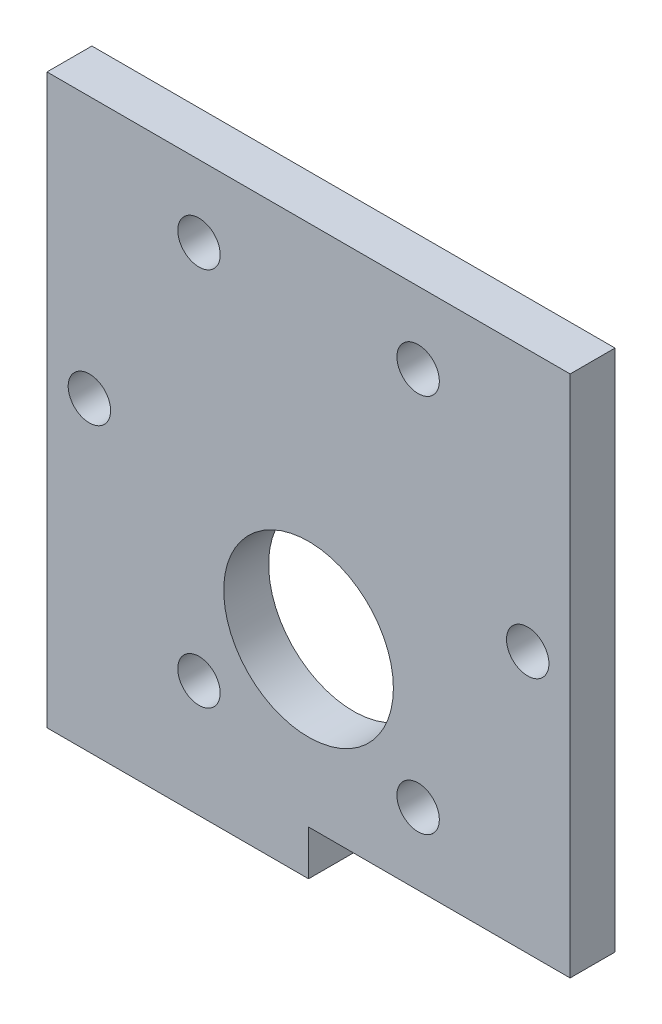
from build123d import *

# Parameters (mm, degrees)
SKETCH1_R           = 6
SKETCH1_R_2         = 1.5
BOSS_EXTRUDE1_DEPTH = 3.175


with BuildPart() as part:
    # Sketch1 → Boss-Extrude1 (new body)
    with BuildSketch(Plane.XY):
        Polygon((18.5, 0), (18.5, -3.175), (0, -3.175), (0, 0), (0, 37), (37, 37), (37, 0), align=None)
        with Locations((18.5, 11.5)):
            Circle(SKETCH1_R, mode=Mode.SUBTRACT)
        with Locations((34, 18.5)):
            Circle(SKETCH1_R_2, mode=Mode.SUBTRACT)
        with Locations((26.25, 5.076606241)):
            Circle(SKETCH1_R_2, mode=Mode.SUBTRACT)
        with Locations((10.75, 5.076606241)):
            Circle(SKETCH1_R_2, mode=Mode.SUBTRACT)
        with Locations((3, 18.5)):
            Circle(SKETCH1_R_2, mode=Mode.SUBTRACT)
        with Locations((10.75, 31.923393759)):
            Circle(SKETCH1_R_2, mode=Mode.SUBTRACT)
        with Locations((26.25, 31.923393759)):
            Circle(SKETCH1_R_2, mode=Mode.SUBTRACT)
    extrude(amount=BOSS_EXTRUDE1_DEPTH)


solid = part.part
